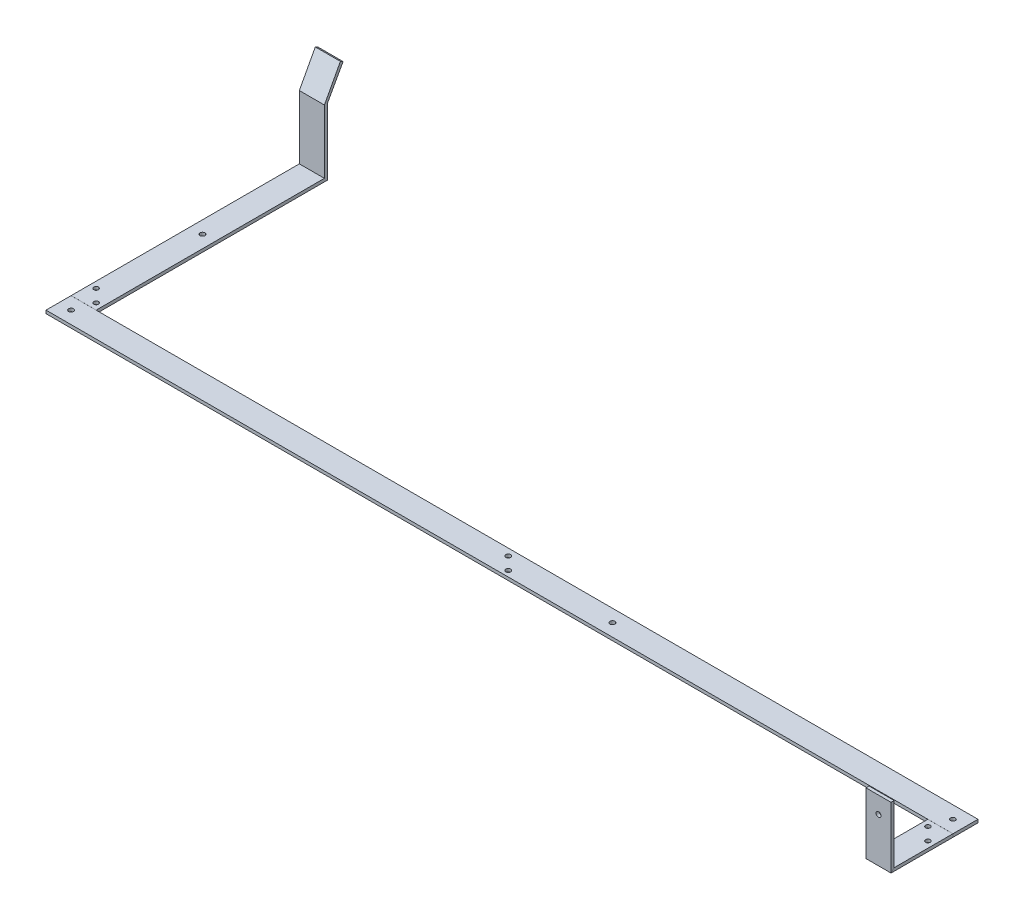
from build123d import *

# Parameters (mm, degrees)
CROQUIS2_W              = 50.8
CROQUIS2_H              = 135
SALIENTE_EXTRUIR1_DEPTH = 6.31
CROQUIS3_W              = 50.8
CROQUIS3_H              = 6.31
SALIENTE_EXTRUIR2_DEPTH = 513.44
CROQUIS4_W              = 50.8
CROQUIS4_H              = 6.31
SALIENTE_EXTRUIR3_DEPTH = 1787.3
CROQUIS9_W              = 50.8
CROQUIS9_H              = 6.31
SALIENTE_EXTRUIR4_DEPTH = 98
CROQUIS12_R             = 5
CORTAR_EXTRUIR1_DEPTH   = 10
CORTAR_EXTRUIR2_DEPTH   = 73
CROQUIS16_W             = 47.2
CROQUIS16_H             = 68.495521413
CORTAR_EXTRUIR5_DEPTH   = 10
CROQUIS17_W             = 50.8
CROQUIS17_H             = 0.1
CORTAR_EXTRUIR6_DEPTH   = 50.8
CROQUIS18_W             = 50.8
CROQUIS18_H             = 0.1
CORTAR_EXTRUIR7_DEPTH   = 50.8
CROQUIS19_R             = 5
CORTAR_EXTRUIR8_DEPTH   = 33
CROQUIS20_R             = 5
CORTAR_EXTRUIR9_DEPTH   = 33
CROQUIS21_R             = 5
CORTAR_EXTRUIR10_DEPTH  = 10
CROQUIS23_R             = 4.7625
CORTAR_EXTRUIR11_DEPTH  = 10
CROQUIS24_R             = 4.7625
CORTAR_EXTRUIR12_DEPTH  = 50
CROQUIS25_R             = 4.7625
CORTAR_EXTRUIR13_DEPTH  = 50
CROQUIS26_R             = 5
CORTAR_EXTRUIR14_DEPTH  = 50
CROQUIS27_R             = 5
CORTAR_EXTRUIR15_DEPTH  = 50


with BuildPart() as part:
    # Croquis2 → Saliente-Extruir1 (new body)
    with BuildSketch(Plane.XY):
        Rectangle(CROQUIS2_W, CROQUIS2_H)
    extrude(amount=SALIENTE_EXTRUIR1_DEPTH)

    # Croquis3 → Saliente-Extruir2 (add)
    with BuildSketch(Plane.XY.offset(6.31)):
        with Locations((0, -64.345)):
            Rectangle(CROQUIS3_W, CROQUIS3_H)
    extrude(amount=SALIENTE_EXTRUIR2_DEPTH)

    # Croquis4 → Saliente-Extruir3 (add)
    with BuildSketch(Plane(origin=(25.4, 0, 0), x_dir=(0, 0, -1), z_dir=(1, 0, 0))):
        with Locations((-494.35, -64.345)):
            Rectangle(CROQUIS4_W, CROQUIS4_H)
    extrude(amount=SALIENTE_EXTRUIR3_DEPTH)

    # Barrer2: sweep along a curve in space
    with BuildLine() as barrer2_path:
        Line((1787.3, -64.345, 519.75), (1787.3, -64.345, 642.06))
        Line((1787.3, -64.345, 642.06), (1787.3, 66.675, 642.06))
        Line((1787.3, 66.675, 642.06), (1787.3, 66.675, 1436.06))
    # Croquis9 → Barrer2 (sweep)
    with BuildSketch(Plane.XY.offset(519.75)):
        with Locations((1787.3, -64.345)):
            Rectangle(CROQUIS9_W, CROQUIS9_H)
    sweep(path=barrer2_path.line, transition=Transition.RIGHT)

    # Croquis11 → Saliente-Extruir4 (add)
    with BuildSketch(Plane.ZY.offset(25.4)):
        Polygon((0, 67.5), (-31.60126178, 124.808722595), (-26.075659426, 127.855658535), (6.31, 67.5), align=None)
    extrude(amount=-SALIENTE_EXTRUIR4_DEPTH)

    # Croquis12 → Cortar-Extruir1 (cut)
    with BuildSketch(Plane(origin=(0, 69.83, 0), x_dir=(1, 0, 0), z_dir=(0, 1, 0))):
        with Locations((1787.3, -1403.06)):
            Circle(CROQUIS12_R)
        with Locations((1787.3, -1183.06)):
            Circle(CROQUIS12_R)
    extrude(amount=-CORTAR_EXTRUIR1_DEPTH, mode=Mode.SUBTRACT)

    # Croquis13 → Cortar-Extruir2 (cut)
    with BuildSketch(Plane(origin=(1812.7, 0, 0), x_dir=(0, 0, -1), z_dir=(1, 0, 0))):
        Polygon((-645.215, 56.71628726), (-638.905, 56.71628726), (-638.905, 69.83), (-1436.06, 69.83), (-1436.06, 63.52), (-645.215, 63.52), align=None)
    extrude(amount=-CORTAR_EXTRUIR2_DEPTH, mode=Mode.SUBTRACT)

    # Croquis16 → Cortar-Extruir5 (cut)
    with BuildSketch(Plane(origin=(0, 17.718759704, 33.021634554), x_dir=(1, 0, 0), z_dir=(0, 0.47281426227300877, 0.8811621152723433))):
        with Locations((49, 90.742745493)):
            Rectangle(CROQUIS16_W, CROQUIS16_H)
    extrude(amount=-CORTAR_EXTRUIR5_DEPTH, mode=Mode.SUBTRACT)

    # Croquis17 → Cortar-Extruir6 (cut)
    with BuildSketch(Plane(origin=(0, -61.19, 0), x_dir=(1, 0, 0), z_dir=(0, 1, 0))):
        with Locations((0, -468.9)):
            Rectangle(CROQUIS17_W, CROQUIS17_H)
    extrude(amount=-CORTAR_EXTRUIR6_DEPTH, mode=Mode.SUBTRACT)


with BuildPart() as cortar_extruir6_piece_1:
    # of the separate pieces the step leaves, piece 1, a body of its own (cortar_extruir6_pieces)
    add(part.part.solids().sort_by_distance((-25.4, -61.19, 468.95))[0])

    # Croquis18 → Cortar-Extruir7 (cut)
    with BuildSketch(Plane(origin=(0, -61.19, 0), x_dir=(1, 0, 0), z_dir=(0, 1, 0))):
        with Locations((1787.3, -519.8)):
            Rectangle(CROQUIS18_W, CROQUIS18_H)
    extrude(amount=-CORTAR_EXTRUIR7_DEPTH, mode=Mode.SUBTRACT)


with BuildPart() as cortar_extruir6_piece_2:
    # of the separate pieces the step leaves, piece 2, a body of its own (cortar_extruir6_pieces)
    add(part.part.solids().sort_by_distance((-25.4, -61.19, 6.31))[0])

    # Croquis23 → Cortar-Extruir11 (cut)
    with BuildSketch(Plane(origin=(0, -67.5, 0), x_dir=(-1, 0, 0), z_dir=(0, -1, 0))):
        with Locations((12.7, -430.85)):
            Circle(CROQUIS23_R)
        with Locations((-12.7, -456.25)):
            Circle(CROQUIS23_R)
    extrude(amount=-CORTAR_EXTRUIR11_DEPTH, mode=Mode.SUBTRACT)

    # Croquis26 → Cortar-Extruir14 (cut)
    with BuildSketch(Plane(origin=(0, -67.5, 0), x_dir=(-1, 0, 0), z_dir=(0, -1, 0))):
        with Locations((0, -227.952204666)):
            Circle(CROQUIS26_R)
    extrude(amount=-CORTAR_EXTRUIR14_DEPTH, mode=Mode.SUBTRACT)


with BuildPart() as cortar_extruir7_piece_1:
    # of the separate pieces the step leaves, piece 1, a body of its own (cortar_extruir7_pieces)
    add(cortar_extruir6_piece_1.part.solids().sort_by_distance((-25.4, -61.19, 468.95))[0])

    # Croquis19 → Cortar-Extruir8 (cut)
    with BuildSketch(Plane(origin=(0, -67.5, 0), x_dir=(-1, 0, 0), z_dir=(0, -1, 0))):
        with Locations((-1097.299999999, -494.35)):
            Circle(CROQUIS19_R)
    extrude(amount=-CORTAR_EXTRUIR8_DEPTH, mode=Mode.SUBTRACT)

    # Croquis21 → Cortar-Extruir10 (cut)
    with BuildSketch(Plane(origin=(0, -67.5, 0), x_dir=(-1, 0, 0), z_dir=(0, -1, 0))):
        with Locations((-899.999999999, -508.245)):
            Circle(CROQUIS21_R)
        with Locations((-874.599999999, -482.845)):
            Circle(CROQUIS21_R)
    extrude(amount=-CORTAR_EXTRUIR10_DEPTH, mode=Mode.SUBTRACT)

    # Croquis25 → Cortar-Extruir13 (cut)
    with BuildSketch(Plane(origin=(0, -67.5, 0), x_dir=(-1, 0, 0), z_dir=(0, -1, 0))):
        with Locations((-1787.3, -494.35)):
            Circle(CROQUIS25_R)
    extrude(amount=-CORTAR_EXTRUIR13_DEPTH, mode=Mode.SUBTRACT)

    # Croquis27 → Cortar-Extruir15 (cut)
    with BuildSketch(Plane(origin=(0, -67.5, 0), x_dir=(-1, 0, 0), z_dir=(0, -1, 0))):
        with Locations((0, -494.35)):
            Circle(CROQUIS27_R)
    extrude(amount=-CORTAR_EXTRUIR15_DEPTH, mode=Mode.SUBTRACT)


with BuildPart() as cortar_extruir7_piece_2:
    # of the separate pieces the step leaves, piece 2, a body of its own (cortar_extruir7_pieces)
    add(cortar_extruir6_piece_1.part.solids().sort_by_distance((1812.7, -61.19, 638.905))[0])

    # Croquis20 → Cortar-Extruir9 (cut)
    with BuildSketch(Plane(origin=(0, 0, 638.905), x_dir=(-1, 0, 0), z_dir=(0, 0, -1))):
        with Locations((-1787.3, 22.71628726)):
            Circle(CROQUIS20_R)
    extrude(amount=-CORTAR_EXTRUIR9_DEPTH, mode=Mode.SUBTRACT)

    # Croquis24 → Cortar-Extruir12 (cut)
    with BuildSketch(Plane(origin=(0, -67.5, 0), x_dir=(-1, 0, 0), z_dir=(0, -1, 0))):
        with Locations((-1800, -557.85)):
            Circle(CROQUIS24_R)
        with Locations((-1774.6, -532.45)):
            Circle(CROQUIS24_R)
    extrude(amount=-CORTAR_EXTRUIR12_DEPTH, mode=Mode.SUBTRACT)


solid = Compound([cortar_extruir6_piece_2.part, cortar_extruir7_piece_1.part, cortar_extruir7_piece_2.part])
